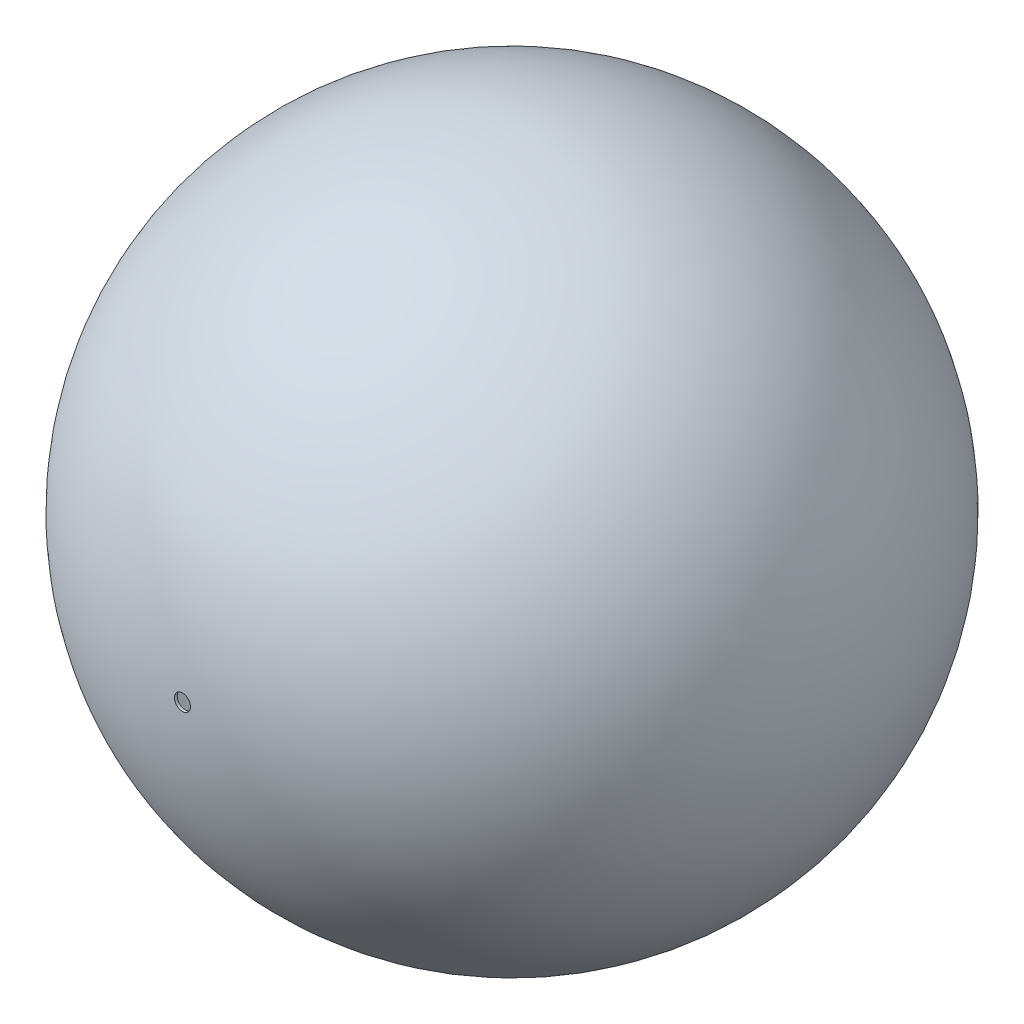
from build123d import *

# Parameters (mm, degrees)
REVOLVE6_ANGLE          = 180.0000000000004
CUT_EXTRUDE1_DEPTH      = 581.8775086022882
CUT_EXTRUDE1_DEPTH_BACK = 581.8775086022882
SKETCH2_R               = 5.5562499999999995


with BuildPart() as part:
    # Sketch1 → Revolve6 (revolve)
    with BuildSketch(Plane.XY):
        with BuildLine():
            Line((-228.59999999999997, 0), (-226.69500000000002, 0))
            ThreePointArc((-226.69500000000002, 0), (1.388e-14, 226.69500000000002), (226.69500000000002, 0))
            Line((226.69500000000002, 0), (228.59999999999997, 0))
            ThreePointArc((228.59999999999997, 0), (1.4e-14, 228.59999999999997), (-228.59999999999997, 0))
        make_face()
    revolve(axis=Axis((0, 0, 0), (1, 0, 0)), revolution_arc=REVOLVE6_ANGLE)

    # Sketch2 → Cut-Extrude1 (cut, two sides: drawn at the far end of the back side and taken through both)
    with BuildSketch(Plane(origin=(5.98e-15, 3.56628e-12, -253.99999999999983), x_dir=(-0.9340477296722021, -0.3571482027033107, -2.4939525698799316e-15), z_dir=(0, -6.98e-15, 1)).offset(-CUT_EXTRUDE1_DEPTH_BACK)):
        with Locations(Location((6.4581e-13, 1.67225e-12, 0), (0, 0, 249.074839669))):
            Circle(SKETCH2_R)
    extrude(amount=CUT_EXTRUDE1_DEPTH + CUT_EXTRUDE1_DEPTH_BACK, mode=Mode.SUBTRACT)

    # Mirror1: part across plane


with BuildPart() as part_1:
    add(part.part)
    add(part.part.mirror(Plane.XY))


solid = part_1.part
